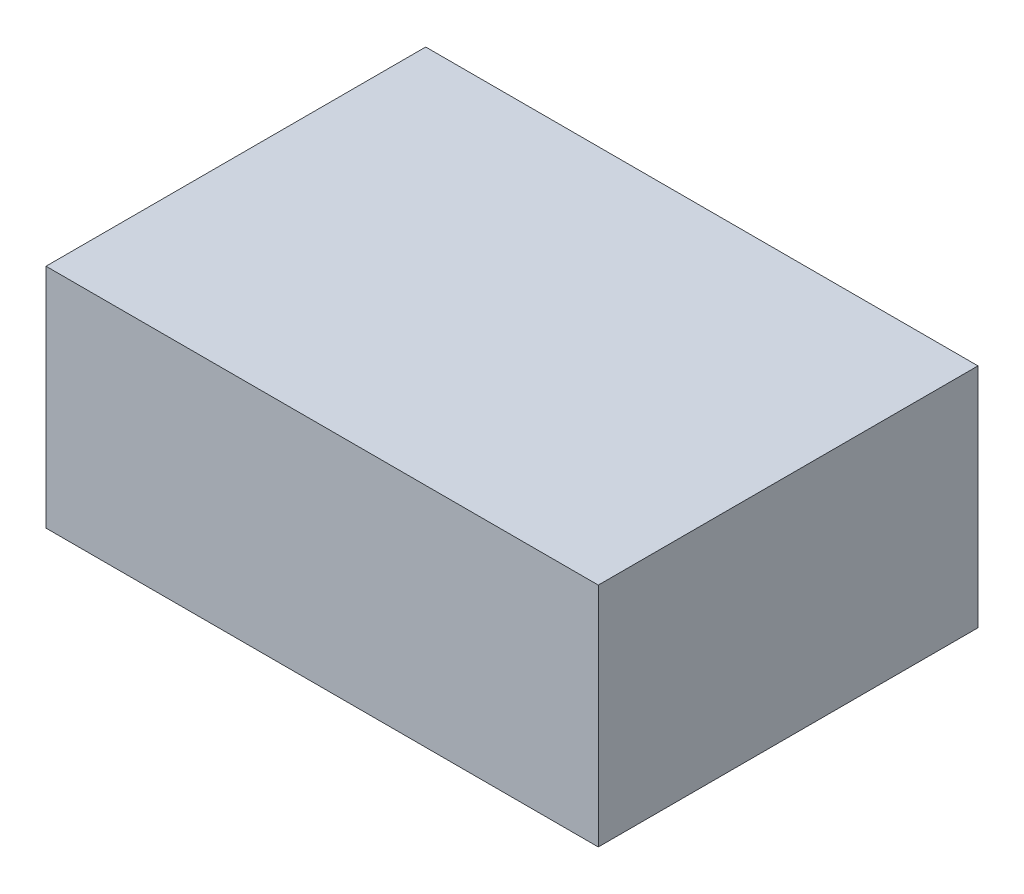
from build123d import *

# Parameters (mm, degrees)
SKETCH1_W           = 1.12
SKETCH1_H           = 0.46
BOSS_EXTRUDE1_DEPTH = 0.77


with BuildPart() as part:
    # Sketch1 → Boss-Extrude1 (new body)
    with BuildSketch(Plane.XY):
        with Locations((0.61, -0.01)):
            Rectangle(SKETCH1_W, SKETCH1_H)
    extrude(amount=-BOSS_EXTRUDE1_DEPTH)


solid = part.part
